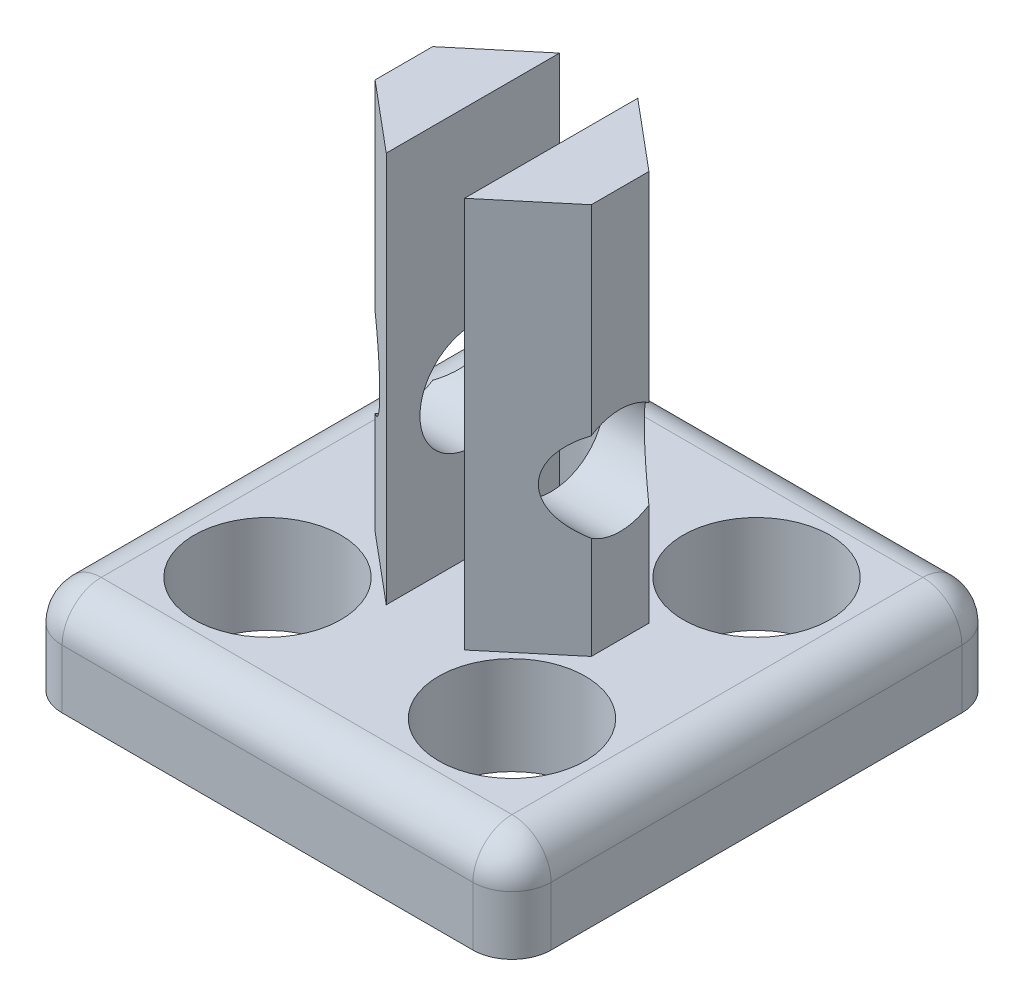
from build123d import *

# Parameters (mm, degrees)
SKETCH1_W           = 12.7
SKETCH1_H           = 12.7
SKETCH1_R           = 1.905
BOSS_EXTRUDE1_DEPTH = 2.54
SKETCH2_W           = 1.791864934
SKETCH2_H           = 1.49598957
BOSS_EXTRUDE2_DEPTH = 10.16
SKETCH3_R           = 1.375
CUT_EXTRUDE1_DEPTH  = 17.896123524
FILLET1_R           = 1.016


with BuildPart() as part:
    # Sketch1 → Boss-Extrude1 (new body)
    with BuildSketch(Plane(origin=(0, 0, 0), x_dir=(1, 0, 0), z_dir=(0, 1, 0))):
        Rectangle(SKETCH1_W, SKETCH1_H)
        with Locations(Location((-3.175, 3.175, 0), (0, 0, 270))):
            Circle(SKETCH1_R, mode=Mode.SUBTRACT)
        with Locations(Location((3.175, 3.175, 0), (0, 0, 90))):
            Circle(SKETCH1_R, mode=Mode.SUBTRACT)
        with Locations(Location((3.175, -3.175, 0), (0, 0, 270))):
            Circle(SKETCH1_R, mode=Mode.SUBTRACT)
        with Locations(Location((-3.175, -3.175, 0), (0, 0, 90))):
            Circle(SKETCH1_R, mode=Mode.SUBTRACT)
    extrude(amount=BOSS_EXTRUDE1_DEPTH)

    # Sketch2 → Boss-Extrude2 (add)
    with BuildSketch(Plane(origin=(0, 2.54, 0), x_dir=(1, 0, 0), z_dir=(0, 1, 0))):
        Polygon((-1.016, 0.747994785), (-1.016, 2.249760645), (-2.807864934, 0.747994785), align=None)
        with Locations((-1.911932467, 0)):
            Rectangle(SKETCH2_W, SKETCH2_H)
        Polygon((-1.016, -2.249760645), (-1.016, -0.747994785), (-2.807864934, -0.747994785), align=None)
        Polygon((2.807864934, 0.747994785), (1.016, 2.249760645), (1.016, 0.747994785), align=None)
        with Locations((1.911932467, 0)):
            Rectangle(SKETCH2_W, SKETCH2_H)
        Polygon((2.807864934, -0.747994785), (1.016, -0.747994785), (1.016, -2.249760645), align=None)
    extrude(amount=BOSS_EXTRUDE2_DEPTH)

    # Sketch3 → Cut-Extrude1 (cut, through all)
    with BuildSketch(Plane(origin=(2.807864934, 0, 0), x_dir=(0, 0, -1), z_dir=(1, 0, 0))):
        with Locations(Location((0, 6.35, 0), (0, 0, 57.043905398))):
            Circle(SKETCH3_R)
    extrude(amount=-CUT_EXTRUDE1_DEPTH, mode=Mode.SUBTRACT)

    # Fillet1
    fillet1_edges = [part.edges().sort_by_distance(p)[0] for p in [
        (-6.35, 2.54, 0),
        (0, 2.54, 6.35),
        (6.35, 2.54, 0),
        (6.35, 1.27, 6.35),
        (-6.35, 1.27, 6.35),
        (-6.35, 1.27, -6.35),
        (6.35, 1.27, -6.35),
        (0, 2.54, -6.35),
    ]]
    fillet(fillet1_edges, radius=FILLET1_R)


solid = part.part
